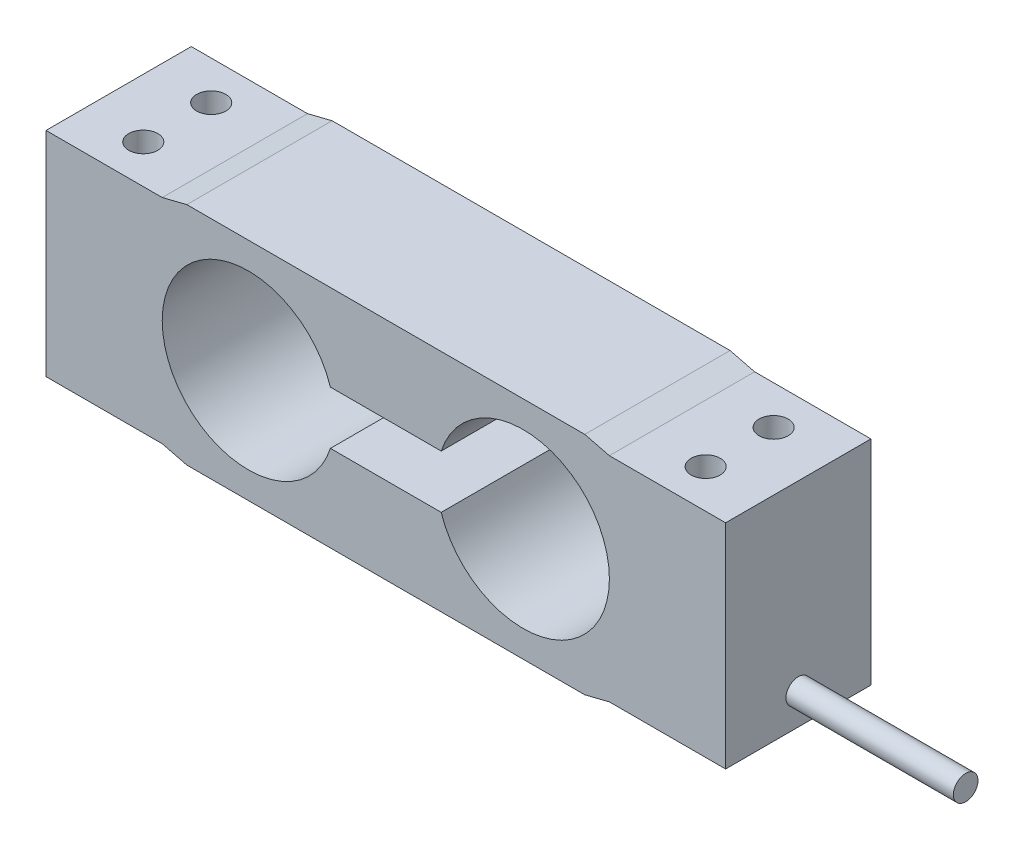
from build123d import *

# Parameters (mm, degrees)
SKETCH1_W           = 70.104
SKETCH1_H           = 14.986
BOSS_EXTRUDE1_DEPTH = 21.9964
CUT_EXTRUDE1_DEPTH  = 75.986616306
SKETCH4_R           = 1.5
CUT_EXTRUDE2_DEPTH  = 75.986616306
SKETCH5_R           = 1.27
BOSS_EXTRUDE2_DEPTH = 17.272
BOSS_EXTRUDE3_DEPTH = 14.986
SKETCH7_W           = 11.9888
SKETCH7_H           = 21.9964
BOSS_EXTRUDE4_DEPTH = 0.508
BOSS_EXTRUDE4_TAPER = 45


with BuildPart() as part:
    # Sketch1 → Boss-Extrude1 (new body)
    with BuildSketch(Plane(origin=(0, 0, 0), x_dir=(1, 0, 0), z_dir=(0, 1, 0))):
        with Locations((-35.052, 7.493)):
            Rectangle(SKETCH1_W, SKETCH1_H)
    extrude(amount=BOSS_EXTRUDE1_DEPTH)

    # Sketch3 → Cut-Extrude1 (cut, through all)
    with BuildSketch(Plane.XY):
        with BuildLine():
            Line((-29.337, 13.735160497), (-40.767, 13.735160497))
            ThreePointArc((-40.767, 13.735160497), (-58.1152, 10.9982), (-40.767, 8.261239503))
            Line((-40.767, 8.261239503), (-29.337, 8.261239503))
            ThreePointArc((-29.337, 8.261239503), (-11.9888, 10.9982), (-29.337, 13.735160497))
        make_face()
        Polygon((-58.1152, 21.9964), (-55.5752, 21.3614), (-14.5288, 21.3614), (-11.9888, 21.9964), align=None)
        Polygon((-58.1152, 0), (-55.5752, 0.635), (-14.5288, 0.635), (-11.9888, 0), align=None)
    extrude(amount=-CUT_EXTRUDE1_DEPTH, mode=Mode.SUBTRACT)

    # Sketch4 → Cut-Extrude2 (cut, through all)
    with BuildSketch(Plane(origin=(0, 21.9964, 0), x_dir=(1, 0, 0), z_dir=(0, 1, 0))):
        with Locations(Location((-64.0588, 10.9982, 0), (0, 0, 270))):
            Circle(SKETCH4_R)
        with Locations(Location((-64.0588, 3.9878, 0), (0, 0, 270))):
            Circle(SKETCH4_R)
        with Locations(Location((-6.0452, 3.9878, 0), (0, 0, 90))):
            Circle(SKETCH4_R)
        with Locations(Location((-6.0452, 10.9982, 0), (0, 0, 90))):
            Circle(SKETCH4_R)
    extrude(amount=-CUT_EXTRUDE2_DEPTH, mode=Mode.SUBTRACT)

    # Sketch5 → Boss-Extrude2 (add)
    with BuildSketch(Plane(origin=(0, 0, 0), x_dir=(0, 0, -1), z_dir=(1, 0, 0))):
        with Locations(Location((7.493, 3.23214606, 0), (0, 0, 180))):
            Circle(SKETCH5_R)
    extrude(amount=BOSS_EXTRUDE2_DEPTH)

    # Sketch6 → Boss-Extrude3 (add, through all)
    with BuildSketch(Plane.XY):
        Polygon((-58.1152, 21.9964), (-55.5752, 21.3614), (-14.5288, 21.3614), (-11.9888, 21.9964), (-14.5288, 22.6314), (-55.5752, 22.6314), align=None)
        Polygon((-55.5752, -0.635), (-14.5288, -0.635), (-11.9888, 0), (-14.5288, 0.635), (-55.5752, 0.635), (-58.1152, 0), align=None)
    extrude(amount=-BOSS_EXTRUDE3_DEPTH)

    # Sketch7 → Boss-Extrude4 (add)
    with BuildSketch(Plane(origin=(0, 0, -14.986), x_dir=(-1, 0, 0), z_dir=(0, 0, -1))):
        with Locations((5.9944, 10.9982)):
            Rectangle(SKETCH7_W, SKETCH7_H)
    extrude(amount=BOSS_EXTRUDE4_DEPTH, taper=BOSS_EXTRUDE4_TAPER)


solid = part.part
